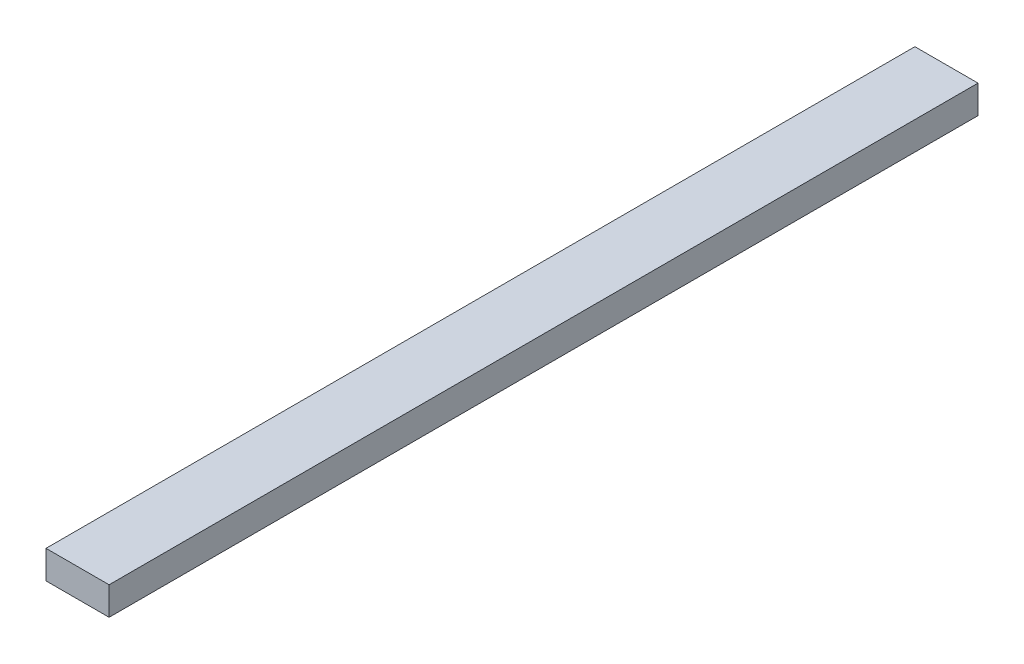
from build123d import *

# Parameters (mm, degrees)
SKETCH1_W           = 16.6624
SKETCH1_H           = 37.2872
BOSS_EXTRUDE1_DEPTH = 256.67


with BuildPart() as part:
    # Sketch1 → Boss-Extrude1 (new, symmetric)
    with BuildSketch(Plane(origin=(0, 0, 0), x_dir=(0, 1, 0), z_dir=(0, 0, 1))):
        Rectangle(SKETCH1_W, SKETCH1_H)
    extrude(amount=BOSS_EXTRUDE1_DEPTH, both=True)


solid = part.part
